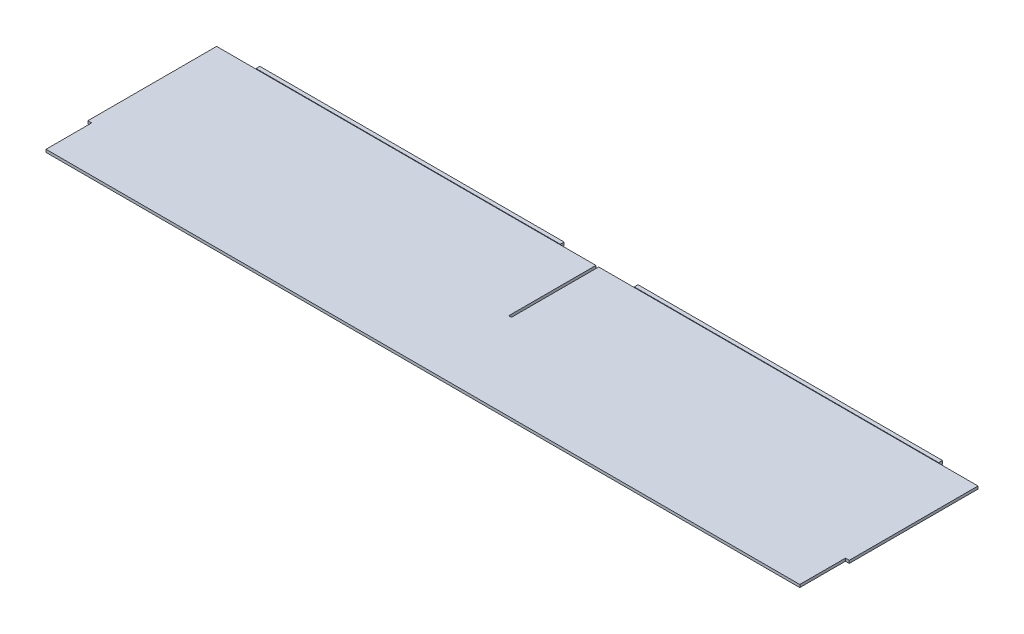
from build123d import *

# Parameters (mm, degrees)
SKETCH1_W           = 635.3556
SKETCH1_H           = 145.542
BOSS_EXTRUDE1_DEPTH = 1.143
SKETCH2_W           = 254
SKETCH2_H           = 2.7305
BOSS_EXTRUDE2_DEPTH = 3.175
SKETCH3_W           = 3.175
SKETCH3_H           = 38.1
CUT_EXTRUDE1_DEPTH  = 327.641141253
SKETCH4_W           = 2.286
SKETCH4_H           = 72.771
CUT_EXTRUDE2_DEPTH  = 327.641141253


with BuildPart() as part:
    # Sketch1 → Boss-Extrude1 (new, symmetric)
    with BuildSketch(Plane(origin=(0, 0, 0), x_dir=(1, 0, 0), z_dir=(0, 1, 0))):
        Rectangle(SKETCH1_W, SKETCH1_H)
    extrude(amount=BOSS_EXTRUDE1_DEPTH, both=True)

    # Sketch2 → Boss-Extrude2 (add)
    with BuildSketch(Plane(origin=(0, 0, -72.771), x_dir=(-1, 0, 0), z_dir=(0, 0, -1))):
        with Locations((-157.8229, 0.22225)):
            Rectangle(SKETCH2_W, SKETCH2_H)
        with Locations((157.8229, 0.22225)):
            Rectangle(SKETCH2_W, SKETCH2_H)
    extrude(amount=BOSS_EXTRUDE2_DEPTH)

    # Sketch3 → Cut-Extrude1 (cut, through all)
    with BuildSketch(Plane.XZ.offset(1.143)):
        with Locations((-316.0903, 53.721)):
            Rectangle(SKETCH3_W, SKETCH3_H)
    cut_extrude1 = extrude(amount=-CUT_EXTRUDE1_DEPTH, mode=Mode.SUBTRACT)

    # Mirror1: Cut-Extrude1 across plane
    add(cut_extrude1.mirror(Plane(origin=(0, 0, 0), x_dir=(0, 0, 1), z_dir=(1, 0, 0))), mode=Mode.SUBTRACT)

    # Sketch4 → Cut-Extrude2 (cut, through all)
    with BuildSketch(Plane.XZ.offset(1.143)):
        with Locations((0, -36.3855)):
            Rectangle(SKETCH4_W, SKETCH4_H)
    extrude(amount=-CUT_EXTRUDE2_DEPTH, mode=Mode.SUBTRACT)


solid = part.part
